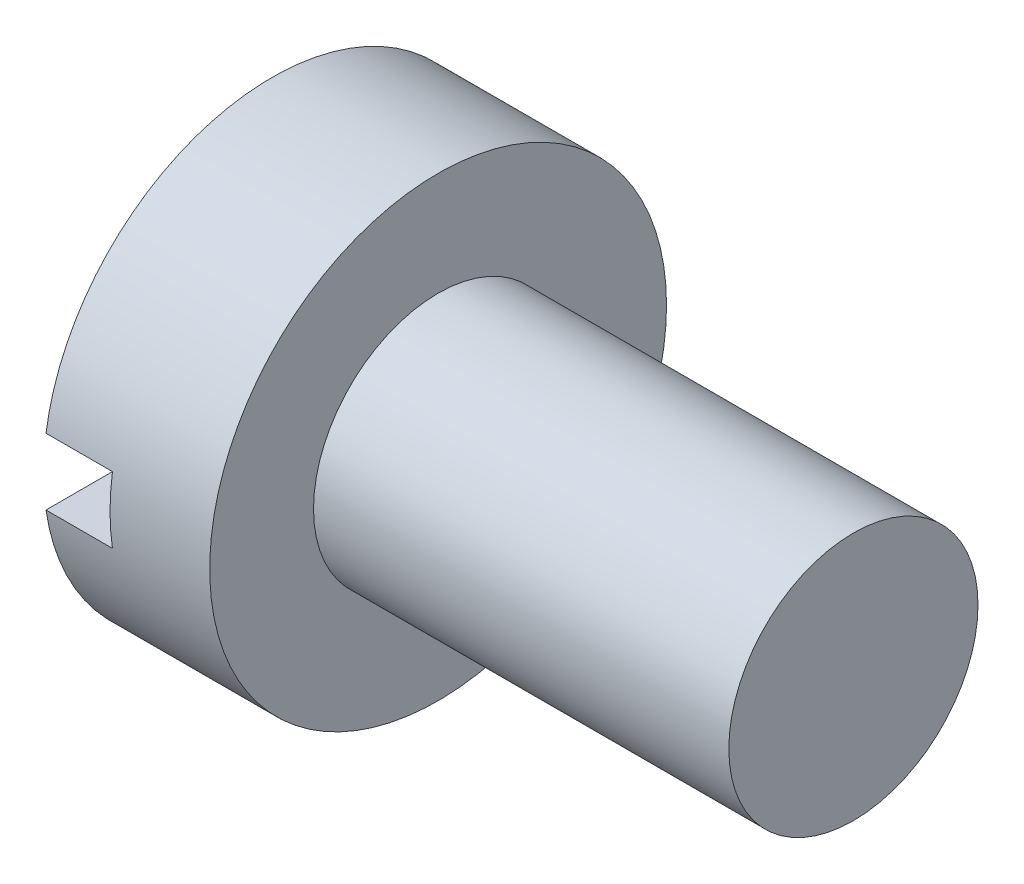
from build123d import *

# Parameters (mm, degrees)
SKETCH2_W          = 5.5
SKETCH2_H          = 0.8
CUT_EXTRUDE1_DEPTH = 0.8


with BuildPart() as part:
    # Sketch1 → Revolve1 (revolve)
    with BuildSketch(Plane.XY, mode=Mode.PRIVATE) as revolve1_sk:
        Polygon((0, 0), (0, 2.75), (2, 2.75), (2, 1.5), (7, 1.5), (7, 0), align=None)
    revolve(revolve1_sk.sketch.rotate(Axis((7, 0, 0), (-1, 0, 0)), 90), axis=Axis((7, 0, 0), (-1, 0, 0)))

    # Sketch2 → Cut-Extrude1 (cut)
    with BuildSketch(Plane.ZY):
        Rectangle(SKETCH2_W, SKETCH2_H)
    extrude(amount=-CUT_EXTRUDE1_DEPTH, mode=Mode.SUBTRACT)


solid = part.part
